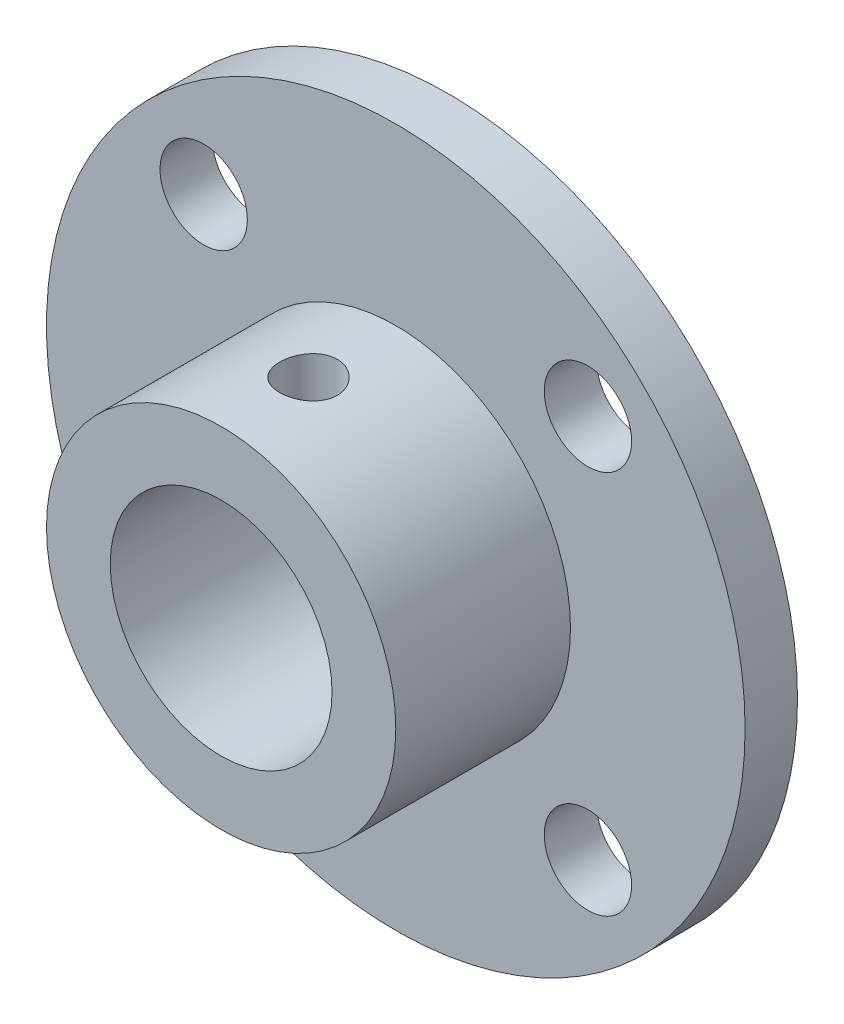
from build123d import *

# Parameters (mm, degrees)
SKETCH1_R                = 20
BOSS_EXTRUDE1_DEPTH      = 3
SKETCH2_R                = 10
BOSS_EXTRUDE2_DEPTH      = 10
SKETCH4_R                = 6.35
CUT_EXTRUDE1_DEPTH       = 32.128764833
M4_TAPPED_HOLE1_REACH    = 38.932
M4_TAPPED_HOLE1_BORE_R   = 1.65
F_5_0_5_DIAMETER_HOLE1_D = 5
CIRPATTERN1_COUNT        = 4


with BuildPart() as part:
    # Sketch1 → Boss-Extrude1 (new body)
    with BuildSketch(Plane.XY):
        Circle(SKETCH1_R)
    extrude(amount=BOSS_EXTRUDE1_DEPTH)

    # Sketch2 → Boss-Extrude2 (add)
    with BuildSketch(Plane.XY.offset(3)):
        Circle(SKETCH2_R)
    extrude(amount=BOSS_EXTRUDE2_DEPTH)

    # Sketch4 → Cut-Extrude1 (cut, through all)
    with BuildSketch(Plane.XY.offset(13)):
        Circle(SKETCH4_R)
    extrude(amount=-CUT_EXTRUDE1_DEPTH, mode=Mode.SUBTRACT)

    # M4 Tapped Hole1 bore (on position points) → M4 Tapped Hole1 (cut, up to next)
    with BuildSketch(Plane(origin=(0, 10, 8), x_dir=(1, 0, 0), z_dir=(0, 1, 0)), mode=Mode.PRIVATE) as m4_tapped_hole1_sk1:
        Circle(M4_TAPPED_HOLE1_BORE_R)
    m4_tapped_hole1_tool1 = extrude(m4_tapped_hole1_sk1.sketch, amount=-M4_TAPPED_HOLE1_REACH, mode=Mode.PRIVATE) & part.part
    add(m4_tapped_hole1_tool1.solids().sort_by_distance((0, 10, 8))[0], mode=Mode.SUBTRACT)

    # Ø5.0 (5) Diameter Hole1 (through all)
    with Locations(Plane(origin=(11, 11, 3), x_dir=(1, 0, 0), z_dir=(0, 0, 1))):
        with Locations((0, 0)):
            f_5_0_5_diameter_hole1 = Hole(F_5_0_5_DIAMETER_HOLE1_D / 2)

    # CirPattern1: Ø5.0 (5) Diameter Hole1 ×4 about axis
    cirpattern1_axis = Axis((0, 0, 0), (0, 0, 1))
    for i in range(1, CIRPATTERN1_COUNT):
        add(f_5_0_5_diameter_hole1.rotate(cirpattern1_axis, i * 360 / CIRPATTERN1_COUNT), mode=Mode.SUBTRACT)


solid = part.part
